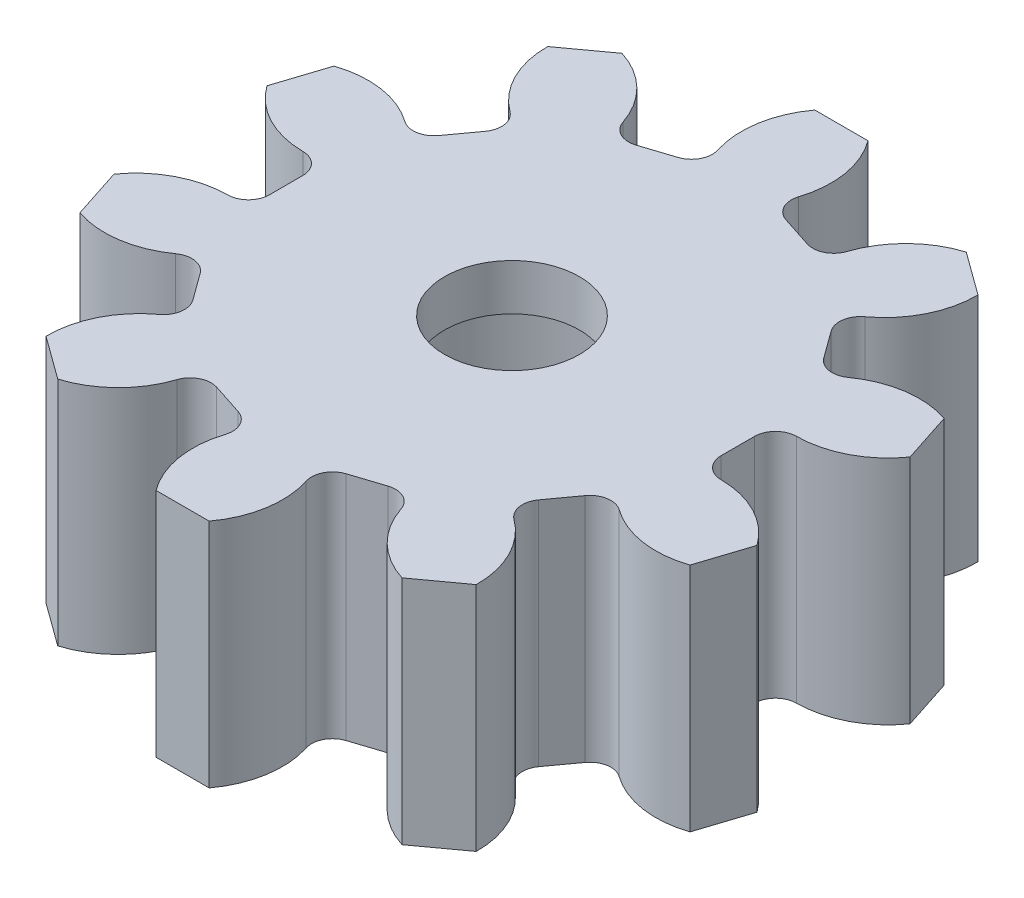
from build123d import *

# Parameters (mm, degrees)
SKETCH1_R           = 2.8625
BOSS_EXTRUDE1_DEPTH = 5
SKETCH2_R           = 2.8625
SKETCH2_R_2         = 1.46
BOSS_EXTRUDE2_DEPTH = 1


with BuildPart() as part:
    # Sketch1 → Boss-Extrude1 (new body)
    with BuildSketch(Plane(origin=(0, 0, 0), x_dir=(1, 0, 0), z_dir=(0, 1, 0))):
        with BuildLine():
            Line((-0.575, 7.126841867), (0, 7.126841867))
            Line((0, 7.126841867), (0.575, 7.126841867))
            ThreePointArc((0.575, 7.126841867), (0.941802699, 6.263909422), (0.875, 5.328637255))
            ThreePointArc((0.875, 5.328637255), (0.903794388, 4.983429203), (1.167554815, 4.758867066))
            Line((1.167554815, 4.758867066), (1.852620192, 4.536275832))
            ThreePointArc((1.852620192, 4.536275832), (2.198001172, 4.562915928), (2.424204523, 4.825270192))
            ThreePointArc((2.424204523, 4.825270192), (2.919899191, 5.62118691), (3.723867773, 6.103712707))
            Line((3.723867773, 6.103712707), (4.189052545, 5.765736187))
            Line((4.189052545, 5.765736187), (4.654237317, 5.427759667))
            ThreePointArc((4.654237317, 5.427759667), (4.443767969, 4.514031436), (3.839984264, 3.796646001))
            ThreePointArc((3.839984264, 3.796646001), (3.660371211, 3.500441903), (3.741763566, 3.163732829))
            Line((3.741763566, 3.163732829), (4.165157254, 2.580981412))
            ThreePointArc((4.165157254, 2.580981412), (4.460234992, 2.399523856), (4.797445315, 2.478813921))
            ThreePointArc((4.797445315, 2.478813921), (5.666298834, 2.831362057), (6.600344627, 2.74917275))
            Line((6.600344627, 2.74917275), (6.778029398, 2.202315253))
            Line((6.778029398, 2.202315253), (6.95571417, 1.655457756))
            ThreePointArc((6.95571417, 1.655457756), (6.248364912, 1.039946868), (5.338225055, 0.814465017))
            ThreePointArc((5.338225055, 0.814465017), (5.018810642, 0.680404772), (4.886745813, 0.360160182))
            Line((4.886745813, 0.360160182), (4.886745813, -0.360160182))
            ThreePointArc((4.886745813, -0.360160182), (5.018810642, -0.680404772), (5.338225055, -0.814465017))
            ThreePointArc((5.338225055, -0.814465017), (6.248364912, -1.039946868), (6.95571417, -1.655457756))
            Line((6.95571417, -1.655457756), (6.778029398, -2.202315253))
            Line((6.778029398, -2.202315253), (6.600344627, -2.74917275))
            ThreePointArc((6.600344627, -2.74917275), (5.666298834, -2.831362057), (4.797445315, -2.478813921))
            ThreePointArc((4.797445315, -2.478813921), (4.460234992, -2.399523856), (4.165157254, -2.580981412))
            Line((4.165157254, -2.580981412), (3.741763566, -3.163732829))
            ThreePointArc((3.741763566, -3.163732829), (3.660371211, -3.500441903), (3.839984264, -3.796646001))
            ThreePointArc((3.839984264, -3.796646001), (4.443767969, -4.514031436), (4.654237317, -5.427759667))
            Line((4.654237317, -5.427759667), (4.189052545, -5.765736187))
            Line((4.189052545, -5.765736187), (3.723867773, -6.103712707))
            ThreePointArc((3.723867773, -6.103712707), (2.919899191, -5.62118691), (2.424204523, -4.825270192))
            ThreePointArc((2.424204523, -4.825270192), (2.198001172, -4.562915928), (1.852620192, -4.536275832))
            Line((1.852620192, -4.536275832), (1.167554815, -4.758867066))
            ThreePointArc((1.167554815, -4.758867066), (0.903794388, -4.983429203), (0.875, -5.328637255))
            ThreePointArc((0.875, -5.328637255), (0.941802699, -6.263909422), (0.575, -7.126841867))
            Line((0.575, -7.126841867), (0, -7.126841867))
            Line((0, -7.126841867), (-0.575, -7.126841867))
            ThreePointArc((-0.575, -7.126841867), (-0.941802699, -6.263909422), (-0.875, -5.328637255))
            ThreePointArc((-0.875, -5.328637255), (-0.903794388, -4.983429203), (-1.167554815, -4.758867066))
            Line((-1.167554815, -4.758867066), (-1.852620192, -4.536275832))
            ThreePointArc((-1.852620192, -4.536275832), (-2.198001172, -4.562915928), (-2.424204523, -4.825270192))
            ThreePointArc((-2.424204523, -4.825270192), (-2.919899191, -5.62118691), (-3.723867773, -6.103712707))
            Line((-3.723867773, -6.103712707), (-4.189052545, -5.765736187))
            Line((-4.189052545, -5.765736187), (-4.654237317, -5.427759667))
            ThreePointArc((-4.654237317, -5.427759667), (-4.443767969, -4.514031436), (-3.839984264, -3.796646001))
            ThreePointArc((-3.839984264, -3.796646001), (-3.660371211, -3.500441903), (-3.741763566, -3.163732829))
            Line((-3.741763566, -3.163732829), (-4.165157254, -2.580981412))
            ThreePointArc((-4.165157254, -2.580981412), (-4.460234992, -2.399523856), (-4.797445315, -2.478813921))
            ThreePointArc((-4.797445315, -2.478813921), (-5.666298834, -2.831362057), (-6.600344627, -2.74917275))
            Line((-6.600344627, -2.74917275), (-6.778029398, -2.202315253))
            Line((-6.778029398, -2.202315253), (-6.95571417, -1.655457756))
            ThreePointArc((-6.95571417, -1.655457756), (-6.248364912, -1.039946868), (-5.338225055, -0.814465017))
            ThreePointArc((-5.338225055, -0.814465017), (-5.018810642, -0.680404772), (-4.886745813, -0.360160182))
            Line((-4.886745813, -0.360160182), (-4.886745813, 0.360160182))
            ThreePointArc((-4.886745813, 0.360160182), (-5.018810642, 0.680404772), (-5.338225055, 0.814465017))
            ThreePointArc((-5.338225055, 0.814465017), (-6.248364912, 1.039946868), (-6.95571417, 1.655457756))
            Line((-6.95571417, 1.655457756), (-6.778029398, 2.202315253))
            Line((-6.778029398, 2.202315253), (-6.600344627, 2.74917275))
            ThreePointArc((-6.600344627, 2.74917275), (-5.666298834, 2.831362057), (-4.797445315, 2.478813921))
            ThreePointArc((-4.797445315, 2.478813921), (-4.460234992, 2.399523856), (-4.165157254, 2.580981412))
            Line((-4.165157254, 2.580981412), (-3.741763566, 3.163732829))
            ThreePointArc((-3.741763566, 3.163732829), (-3.660371211, 3.500441903), (-3.839984264, 3.796646001))
            ThreePointArc((-3.839984264, 3.796646001), (-4.443767969, 4.514031436), (-4.654237317, 5.427759667))
            Line((-4.654237317, 5.427759667), (-4.189052545, 5.765736187))
            Line((-4.189052545, 5.765736187), (-3.723867773, 6.103712707))
            ThreePointArc((-3.723867773, 6.103712707), (-2.919899191, 5.62118691), (-2.424204523, 4.825270192))
            ThreePointArc((-2.424204523, 4.825270192), (-2.198001172, 4.562915928), (-1.852620192, 4.536275832))
            Line((-1.852620192, 4.536275832), (-1.167554815, 4.758867066))
            ThreePointArc((-1.167554815, 4.758867066), (-0.903794388, 4.983429203), (-0.875, 5.328637255))
            ThreePointArc((-0.875, 5.328637255), (-0.941802699, 6.263909422), (-0.575, 7.126841867))
        make_face()
        with Locations(Location((0, 0, 0), (0, 0, 270))):
            Circle(SKETCH1_R, mode=Mode.SUBTRACT)
    extrude(amount=BOSS_EXTRUDE1_DEPTH)

    # Sketch2 → Boss-Extrude2 (add)
    with BuildSketch(Plane(origin=(0, 4, 0), x_dir=(1, 0, 0), z_dir=(0, 1, 0))):
        with Locations(Location((0, 0, 0), (0, 0, 270))):
            Circle(SKETCH2_R)
        with Locations(Location((0, 0, 0), (0, 0, 270))):
            Circle(SKETCH2_R_2, mode=Mode.SUBTRACT)
    extrude(amount=BOSS_EXTRUDE2_DEPTH)


solid = part.part
